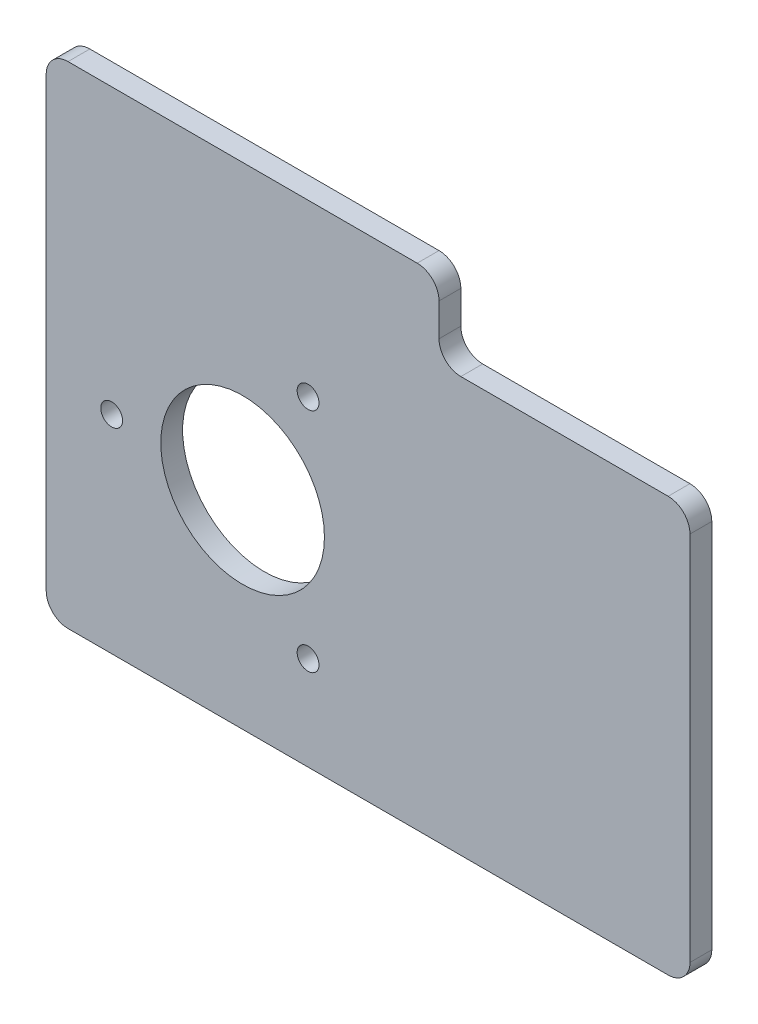
from build123d import *

# Parameters (mm, degrees)
BOARDSKE_R   = 0.5
BOARDSKE_R_2 = 3.75
BOARD_DEPTH  = 1
FILLET_2_R   = 1


with BuildPart() as part:
    # BoardSke → Board (new body)
    with BuildSketch(Plane.XY):
        Polygon((9, 13), (9, 9.5), (20.5, 9.5), (20.5, -9.5), (-9, -9.5), (-9, 13), align=None)
        with Locations((-6, 0)):
            Circle(BOARDSKE_R, mode=Mode.SUBTRACT)
        Circle(BOARDSKE_R_2, mode=Mode.SUBTRACT)
        with Locations((3, 5.196152423)):
            Circle(BOARDSKE_R, mode=Mode.SUBTRACT)
        with Locations((3, -5.196152423)):
            Circle(BOARDSKE_R, mode=Mode.SUBTRACT)
    extrude(amount=BOARD_DEPTH)

    # Fillet 2
    fillet_2_edges = [part.edges().sort_by_distance(p)[0] for p in [
        (9, 13, 0.5),
        (9, 9.5, 0.5),
        (20.5, 9.5, 0.5),
        (20.5, -9.5, 0.5),
        (-9, -9.5, 0.5),
        (-9, 13, 0.5),
    ]]
    fillet(fillet_2_edges, radius=FILLET_2_R)


solid = part.part
